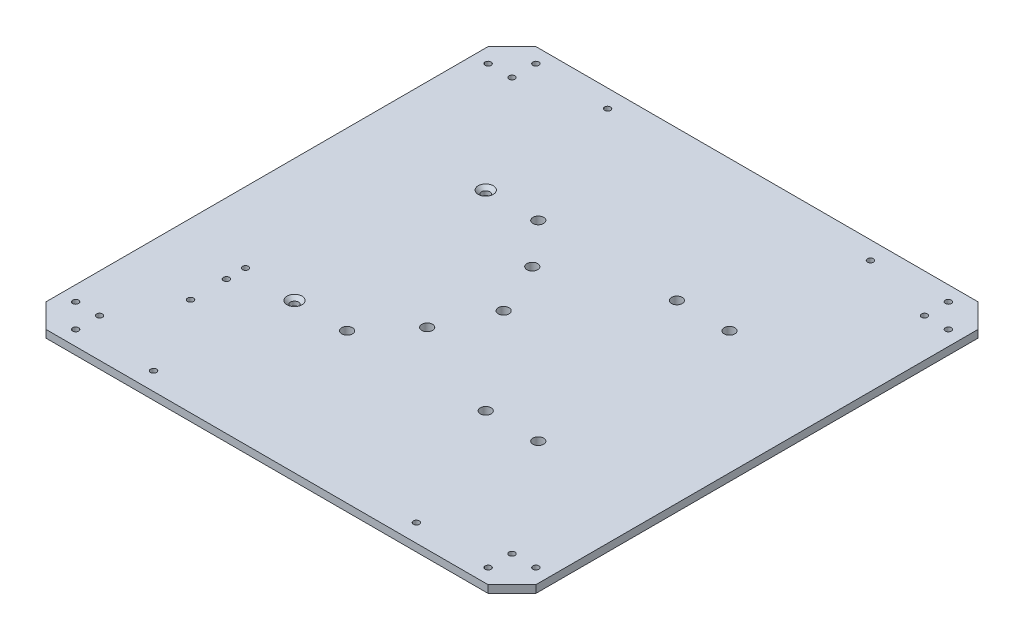
from build123d import *

# Parameters (mm, degrees)
BOSS_EXTRUDE1_DEPTH                             = 3.175
SKETCH2_R                                       = 1.5
SKETCH2_R_2                                     = 2.25
CUT_EXTRUDE1_DEPTH                              = 145.991657088
M3X0_5_TAPPED_HOLE1_D                           = 2.5
SKETCH5_R                                       = 1.25
CUT_EXTRUDE2_DEPTH                              = 145.991657088
SKETCH6_R                                       = 1.25
CUT_EXTRUDE3_DEPTH                              = 10
CSK_FOR_M3_FLAT_HEAD_MACHINE_SCREW1_D           = 3.4
CSK_FOR_M3_FLAT_HEAD_MACHINE_SCREW1_CSINK_D     = 6.3
CSK_FOR_M3_FLAT_HEAD_MACHINE_SCREW1_CSINK_ANGLE = 90


with BuildPart() as part:
    # Sketch1 → Boss-Extrude1 (new body)
    with BuildSketch(Plane(origin=(0, 0, 0), x_dir=(1, 0, 0), z_dir=(0, 1, 0))):
        Polygon((-92.5, 102.5), (92.5, 102.5), (102.5, 92.5), (102.5, -92.5), (92.5, -102.5), (-92.5, -102.5), (-102.5, -92.5), (-102.5, 92.5), align=None)
    extrude(amount=BOSS_EXTRUDE1_DEPTH)

    # Sketch2 → Cut-Extrude1 (cut, through all)
    with BuildSketch(Plane(origin=(0, 3.175, 0), x_dir=(1, 0, 0), z_dir=(0, 1, 0))):
        with Locations(Location((-51, -40, 0), (0, 0, 270))):
            Circle(SKETCH2_R)
        with Locations(Location((-29, -40, 0), (0, 0, 270))):
            Circle(SKETCH2_R_2)
        with Locations(Location((-51, 40, 0), (0, 0, 270))):
            Circle(SKETCH2_R)
        with Locations(Location((-29, 40, 0), (0, 0, 270))):
            Circle(SKETCH2_R_2)
        with Locations(Location((29, 40, 0), (0, 0, 270))):
            Circle(SKETCH2_R_2)
        with Locations(Location((51, 40, 0), (0, 0, 270))):
            Circle(SKETCH2_R_2)
        with Locations(Location((29, -40, 0), (0, 0, 270))):
            Circle(SKETCH2_R_2)
        with Locations(Location((51, -40, 0), (0, 0, 270))):
            Circle(SKETCH2_R_2)
        with Locations(Location((-3.5, 0, 0), (0, 0, 270))):
            Circle(SKETCH2_R_2)
        with Locations(Location((-13.5, 22, 0), (0, 0, 270))):
            Circle(SKETCH2_R_2)
        with Locations(Location((-13.5, -22, 0), (0, 0, 270))):
            Circle(SKETCH2_R_2)
    extrude(amount=-CUT_EXTRUDE1_DEPTH, mode=Mode.SUBTRACT)

    # M3x0.5 Tapped Hole1 (through all)
    with Locations(Plane(origin=(0, 3.175, 0), x_dir=(-1, 0, 0), z_dir=(0, 1, 0))):
        with Locations((96.3, -86.3), (86.3, -96.3), (-86.3, -96.3), (-96.3, -86.3), (-96.3, 86.3), (-86.3, 96.3), (86.3, 96.3), (96.3, 86.3), (-86.3, 86.3), (-86.3, -86.3), (86.3, -86.3), (86.3, 86.3)):
            Hole(M3X0_5_TAPPED_HOLE1_D / 2)

    # Sketch5 → Cut-Extrude2 (cut, through all)
    with BuildSketch(Plane(origin=(0, 3.175, 0), x_dir=(1, 0, 0), z_dir=(0, 1, 0))):
        with Locations(Location((-55, 95, 0), (0, 0, 270))):
            Circle(SKETCH5_R)
        with Locations(Location((55, 95, 0), (0, 0, 270))):
            Circle(SKETCH5_R)
        with Locations(Location((-55, -95, 0), (0, 0, 270))):
            Circle(SKETCH5_R)
        with Locations(Location((55, -95, 0), (0, 0, 270))):
            Circle(SKETCH5_R)
    extrude(amount=-CUT_EXTRUDE2_DEPTH, mode=Mode.SUBTRACT)

    # Sketch6 → Cut-Extrude3 (cut)
    with BuildSketch(Plane(origin=(0, 3.175, 0), x_dir=(1, 0, 0), z_dir=(0, 1, 0))):
        with Locations(Location((-73, -46.5, 0), (0, 0, 270))):
            Circle(SKETCH6_R)
        with Locations(Location((-73, -38.5, 0), (0, 0, 270))):
            Circle(SKETCH6_R)
        with Locations(Location((-73, -61.5, 0), (0, 0, 270))):
            Circle(SKETCH6_R)
    extrude(amount=-CUT_EXTRUDE3_DEPTH, mode=Mode.SUBTRACT)

    # CSK for M3 Flat Head Machine Screw1 (through all)
    with Locations(Plane(origin=(0, 3.175, 0), x_dir=(-1, 0, 0), z_dir=(0, 1, 0))):
        with Locations((51, -40), (51, 40)):
            CounterSinkHole(CSK_FOR_M3_FLAT_HEAD_MACHINE_SCREW1_D / 2, CSK_FOR_M3_FLAT_HEAD_MACHINE_SCREW1_CSINK_D / 2, counter_sink_angle=CSK_FOR_M3_FLAT_HEAD_MACHINE_SCREW1_CSINK_ANGLE)


solid = part.part
